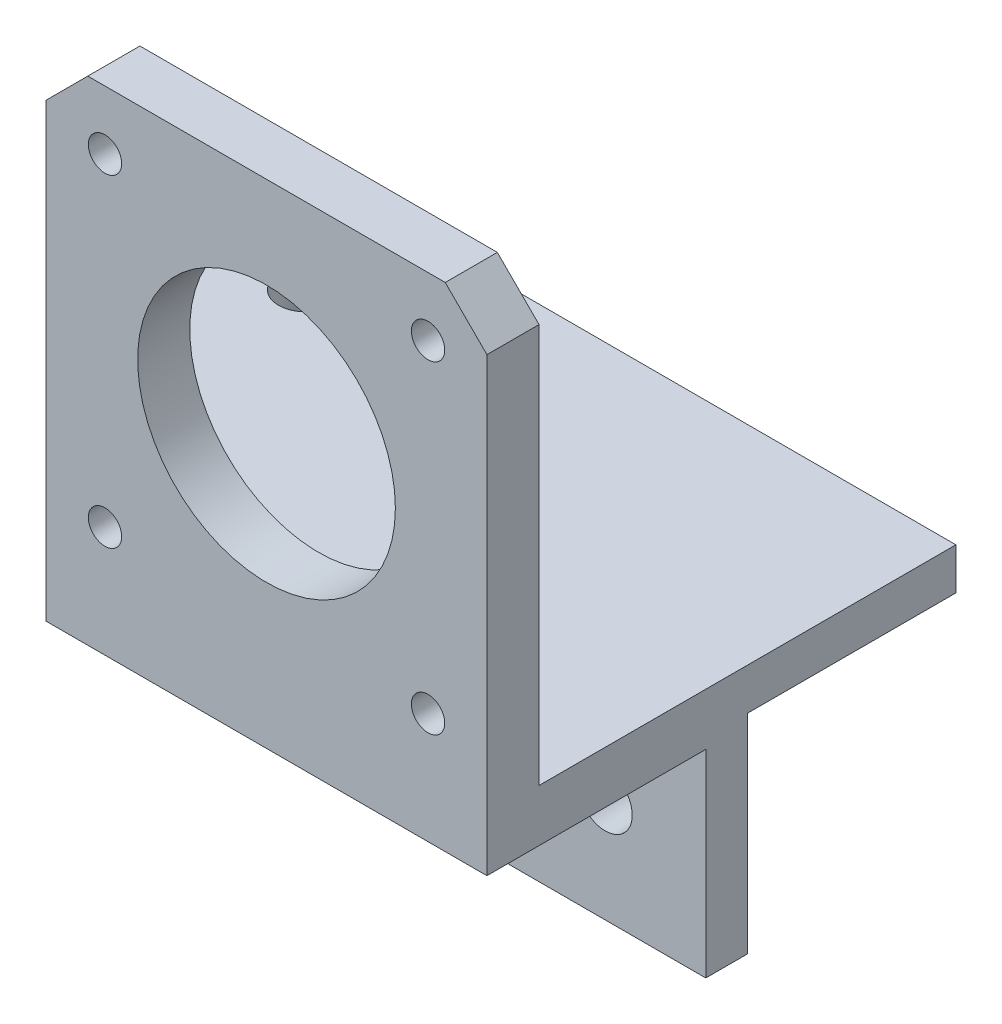
from build123d import *

# Parameters (mm, degrees)
SKICA1_W                 = 62.391596743
SKICA1_H                 = 24
P_IDAT_VYSUNUT_M1_DEPTH  = 4
SKICA2_W                 = 42.3
SKICA2_H                 = 5
P_IDAT_VYSUNUT_M2_DEPTH  = 16
SKICA3_R                 = 1.6
SKICA3_R_2               = 12.36434098
P_IDAT_VYSUNUT_M5_DEPTH  = 5
ZKOSEN_1_SIZE            = 16
SKICA4_R                 = 2.6
ODEBRAT_VYSUNUT_M1_DEPTH = 4
SKICA5_W                 = 62.391596743
SKICA5_H                 = 4
P_IDAT_VYSUNUT_M6_DEPTH  = 20
SKICA6_R                 = 2.6
ODEBRAT_VYSUNUT_M2_DEPTH = 4


with BuildPart() as part:
    # Skica1 → Přidat vysunutím1 (new body)
    with BuildSketch(Plane.XY):
        with Locations((-71.195798372, -0.971059771)):
            Rectangle(SKICA1_W, SKICA1_H)
    extrude(amount=P_IDAT_VYSUNUT_M1_DEPTH)

    # Skica2 → Přidat vysunutím2 (add)
    with BuildSketch(Plane.XY.offset(4)):
        with Locations((-61.15, 8.528940229)):
            Rectangle(SKICA2_W, SKICA2_H)
    extrude(amount=P_IDAT_VYSUNUT_M2_DEPTH)

    # Skica3 → Přidat vysunutím5 (add)
    with BuildSketch(Plane.XY.offset(20)):
        Polygon((-40, 6.028940229), (-82.3, 6.028940229), (-82.3, 49.328940229), (-78.3, 53.328940229), (-44, 53.328940229), (-40, 49.328940229), align=None)
        with Locations((-45.65, 47.678940229)):
            Circle(SKICA3_R, mode=Mode.SUBTRACT)
        with Locations((-76.65, 47.678940229)):
            Circle(SKICA3_R, mode=Mode.SUBTRACT)
        with Locations((-76.65, 16.678940229)):
            Circle(SKICA3_R, mode=Mode.SUBTRACT)
        with Locations((-45.65, 16.678940229)):
            Circle(SKICA3_R, mode=Mode.SUBTRACT)
        with Locations((-61.15, 32.178940229)):
            Circle(SKICA3_R_2, mode=Mode.SUBTRACT)
    extrude(amount=P_IDAT_VYSUNUT_M5_DEPTH)

    # Zkosení1
    zkosen_1_edges = [part.edges().sort_by_distance(p)[0] for p in [
        (-82.3, 8.528940229, 4),
    ]]
    chamfer(zkosen_1_edges, length=ZKOSEN_1_SIZE)

    # Skica4 → Odebrat vysunutím1 (cut)
    with BuildSketch(Plane.XY.offset(4)):
        with Locations((-89.655606689, -2.971059771)):
            Circle(SKICA4_R)
        with Locations((-69.655606689, -2.971059771)):
            Circle(SKICA4_R)
        with Locations((-49.655606689, -2.971059771)):
            Circle(SKICA4_R)
    extrude(amount=-ODEBRAT_VYSUNUT_M1_DEPTH, mode=Mode.SUBTRACT)

    # Skica5 → Přidat vysunutím6 (add)
    with BuildSketch(Plane(origin=(0, 0, 0), x_dir=(-1, 0, 0), z_dir=(0, 0, -1))):
        with Locations((71.195798372, 9.028940229)):
            Rectangle(SKICA5_W, SKICA5_H)
    extrude(amount=P_IDAT_VYSUNUT_M6_DEPTH)

    # Skica6 → Odebrat vysunutím2 (cut)
    with BuildSketch(Plane(origin=(0, 11.028940229, 0), x_dir=(1, 0, 0), z_dir=(0, 1, 0))):
        with Locations(Location((-92.391596743, 10, 0), (0, 0, 270))):
            Circle(SKICA6_R)
    extrude(amount=-ODEBRAT_VYSUNUT_M2_DEPTH, mode=Mode.SUBTRACT)


solid = part.part
